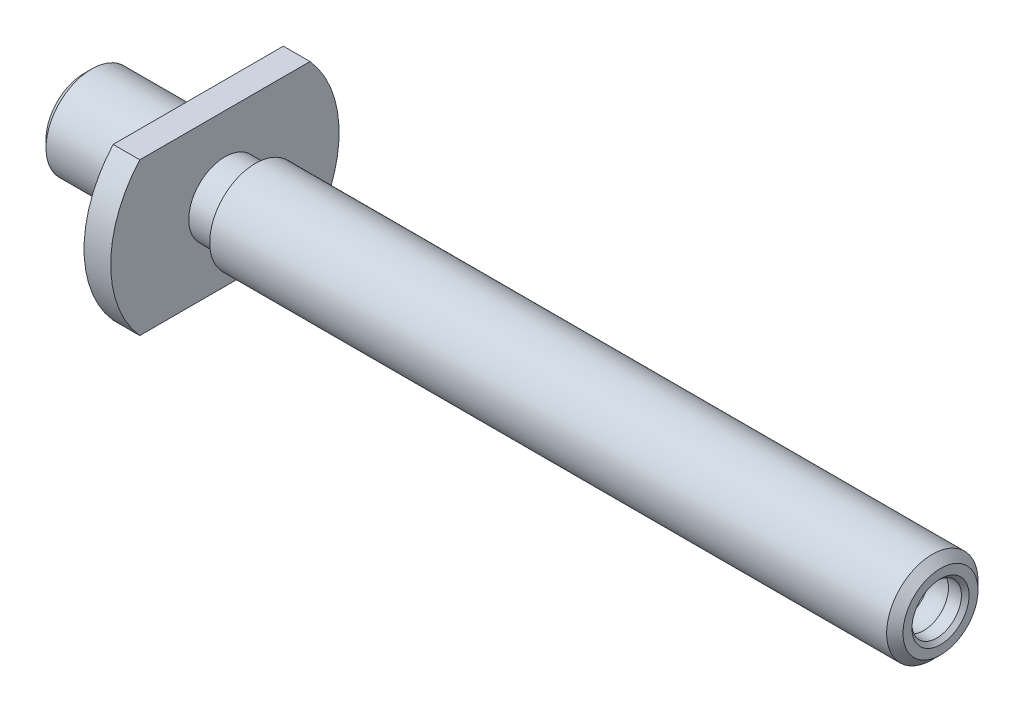
from build123d import *

# Parameters (mm, degrees)
CHANFREIN2_SIZE = 1
M_PLATS_DEPTH   = 97.363893653


with BuildPart() as part:
    # Esquisse1 → Forme de révolution (revolve)
    with BuildSketch(Plane.XY, mode=Mode.PRIVATE) as forme_de_r_volution_sk:
        with BuildLine():
            Line((-15, 0), (89.91678311, 0))
            Line((89.91678311, 0), (91.869580122, 3.25))
            Line((91.869580122, 3.25), (92.700961894, 3.25))
            ThreePointArc((92.700961894, 3.25), (94, 3.5), (95.299038106, 3.25))
            Line((95.299038106, 3.25), (97, 3.25))
            Line((97, 3.25), (97.5, 3.75))
            Line((97.5, 3.75), (97.5, 4.92655))
            Line((97.5, 4.92655), (96.42655, 6))
            Line((96.42655, 6), (7.5, 6))
            Line((7.5, 6), (7.5, 4.75))
            Line((7.5, 4.75), (3.5, 4.75))
            Line((3.5, 4.75), (3.5, 15))
            Line((3.5, 15), (0, 15))
            Line((0, 15), (0, 6))
            Line((0, 6), (-15, 6))
            Line((-15, 6), (-15, 0))
        make_face()
    revolve(forme_de_r_volution_sk.sketch.rotate(Axis((110.666531714, 0, 0), (-1, 0, 0)), 90), axis=Axis((110.666531714, 0, 0), (-1, 0, 0)))

    # Chanfrein2
    chanfrein2_edges = [part.edges().sort_by_distance(p)[0] for p in [
        (-15, 0, 6),
    ]]
    chamfer(chanfrein2_edges, length=CHANFREIN2_SIZE)

    # Esquisse3 → Méplats (cut, symmetric)
    with BuildSketch(Plane(origin=(3.5, 0, 0), x_dir=(0, 0, -1), z_dir=(1, 0, 0))):
        Polygon((-103.669154566, 10), (-15.223201291, 10), (13.534968643, 10), (101.980921918, 10), (101.980921918, 186.891906549), (-103.669154566, 186.891906549), align=None)
    m_plats = extrude(amount=M_PLATS_DEPTH, both=True, mode=Mode.SUBTRACT)

    # Symétrie1: Méplats across plane
    add(m_plats.mirror(Plane.ZX), mode=Mode.SUBTRACT)


solid = part.part
